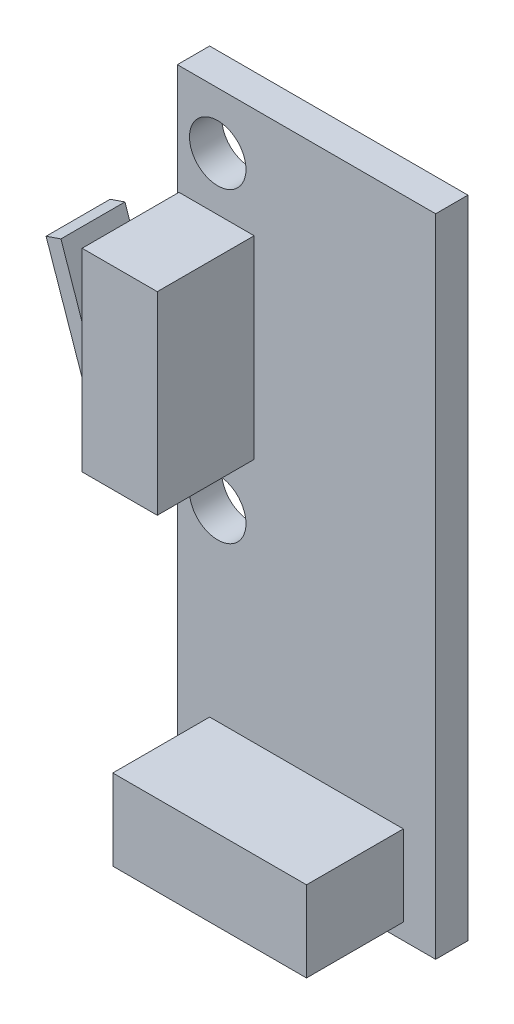
from build123d import *

# Parameters (mm, degrees)
ESBO_O1_W                     = 16
ESBO_O1_H                     = 40
RESSALTO_EXTRUS_O1_DEPTH      = 2
ESBO_O2_R                     = 1.75
CORTE_EXTRUS_O1_DEPTH         = 2
ESBO_O3_W                     = 4.656179748
ESBO_O3_H                     = 12
RESSALTO_EXTRUS_O2_DEPTH      = 6
ESBO_O4_W                     = 12
ESBO_O4_H                     = 5
RESSALTO_EXTRUS_O3_DEPTH      = 6
RESSALTO_EXTRUS_O4_DEPTH      = 9
RESSALTO_EXTRUS_O4_DEPTH_BACK = 1.2
ESBO_O6_W                     = 3.964999664
ESBO_O6_H                     = 0.972728158


with BuildPart() as part:
    # Esboço1 → Ressalto-extrusão1 (new body)
    with BuildSketch(Plane.XY):
        Rectangle(ESBO_O1_W, ESBO_O1_H)
    extrude(amount=RESSALTO_EXTRUS_O1_DEPTH)

    # Esboço2 → Corte-extrusão1 (cut)
    with BuildSketch(Plane.XY.offset(2)):
        with Locations((-5.5, 16.5)):
            Circle(ESBO_O2_R)
        with Locations((-5.5, -2.5)):
            Circle(ESBO_O2_R)
    extrude(amount=-CORTE_EXTRUS_O1_DEPTH, mode=Mode.SUBTRACT)

    # Esboço3 → Ressalto-extrusão2 (add)
    with BuildSketch(Plane.XY.offset(2)):
        with Locations((-5.571910126, 7.2)):
            Rectangle(ESBO_O3_W, ESBO_O3_H)
    extrude(amount=RESSALTO_EXTRUS_O2_DEPTH)

    # Esboço4 → Ressalto-extrusão3 (add)
    with BuildSketch(Plane.XY.offset(2)):
        with Locations((0, -16.5)):
            Rectangle(ESBO_O4_W, ESBO_O4_H)
    extrude(amount=RESSALTO_EXTRUS_O3_DEPTH)

    # Esboço6 → Ressalto-extrusão4 (add, two sides: drawn at the far end of the back side and taken through both)
    with BuildSketch(Plane(origin=(-4.396287548, 12.767746119, 0), x_dir=(0, 0, -1), z_dir=(0.32556815445715404, -0.9455185755993177, 0)).offset(-RESSALTO_EXTRUS_O4_DEPTH_BACK)):
        with Locations((-5, -6.243358943)):
            Rectangle(ESBO_O6_W, ESBO_O6_H)
    extrude(amount=RESSALTO_EXTRUS_O4_DEPTH + RESSALTO_EXTRUS_O4_DEPTH_BACK)


solid = part.part
